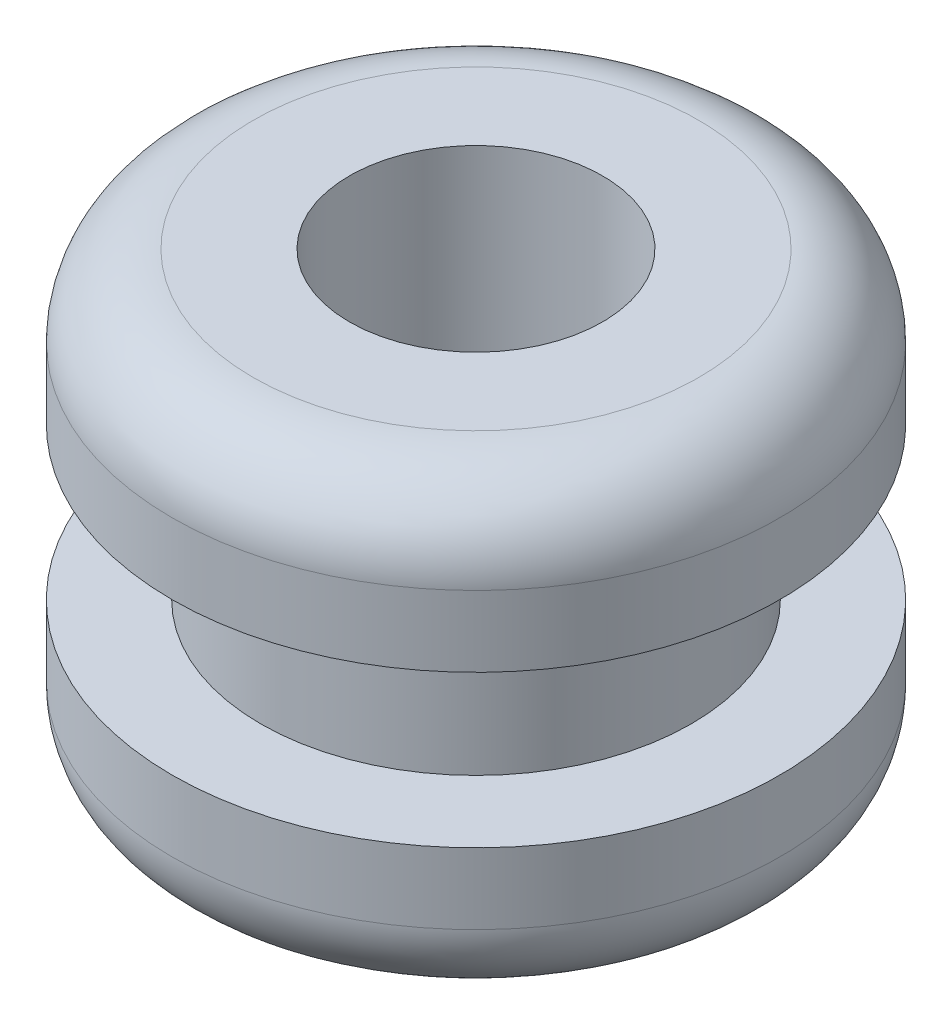
from build123d import *

# Parameters (mm, degrees)
SKETCH2_R           = 9.525
BOSS_EXTRUDE1_DEPTH = 7.14375
SKETCH3_R           = 9.525
SKETCH3_R_2         = 6.746875
CUT_EXTRUDE1_DEPTH  = 2.38125
FILLET1_R           = 2.54
SKETCH4_R           = 3.96875
CUT_EXTRUDE2_DEPTH  = 20.636290542


with BuildPart() as part:
    # Sketch2 → Boss-Extrude1 (new, symmetric)
    with BuildSketch(Plane(origin=(0, 0, 0), x_dir=(1, 0, 0), z_dir=(0, 1, 0))):
        with Locations(Location((0, 0, 0), (0, 0, 270))):
            Circle(SKETCH2_R)
    extrude(amount=BOSS_EXTRUDE1_DEPTH, both=True)

    # Sketch3 → Cut-Extrude1 (cut, symmetric)
    with BuildSketch(Plane(origin=(0, 0, 0), x_dir=(1, 0, 0), z_dir=(0, 1, 0))):
        with Locations(Location((0, 0, 0), (0, 0, 270))):
            Circle(SKETCH3_R)
        with Locations(Location((0, 0, 0), (0, 0, 270))):
            Circle(SKETCH3_R_2, mode=Mode.SUBTRACT)
    extrude(amount=CUT_EXTRUDE1_DEPTH, both=True, mode=Mode.SUBTRACT)

    # Fillet1
    fillet1_edges = [part.edges().sort_by_distance(p)[0] for p in [
        (0, -7.14375, -9.525),
        (0, 7.14375, -9.525),
    ]]
    fillet(fillet1_edges, radius=FILLET1_R)

    # Sketch4 → Cut-Extrude2 (cut, through all)
    with BuildSketch(Plane(origin=(0, 7.14375, 0), x_dir=(1, 0, 0), z_dir=(0, 1, 0))):
        with Locations(Location((0, 0, 0), (0, 0, 270))):
            Circle(SKETCH4_R)
    extrude(amount=-CUT_EXTRUDE2_DEPTH, mode=Mode.SUBTRACT)


solid = part.part
